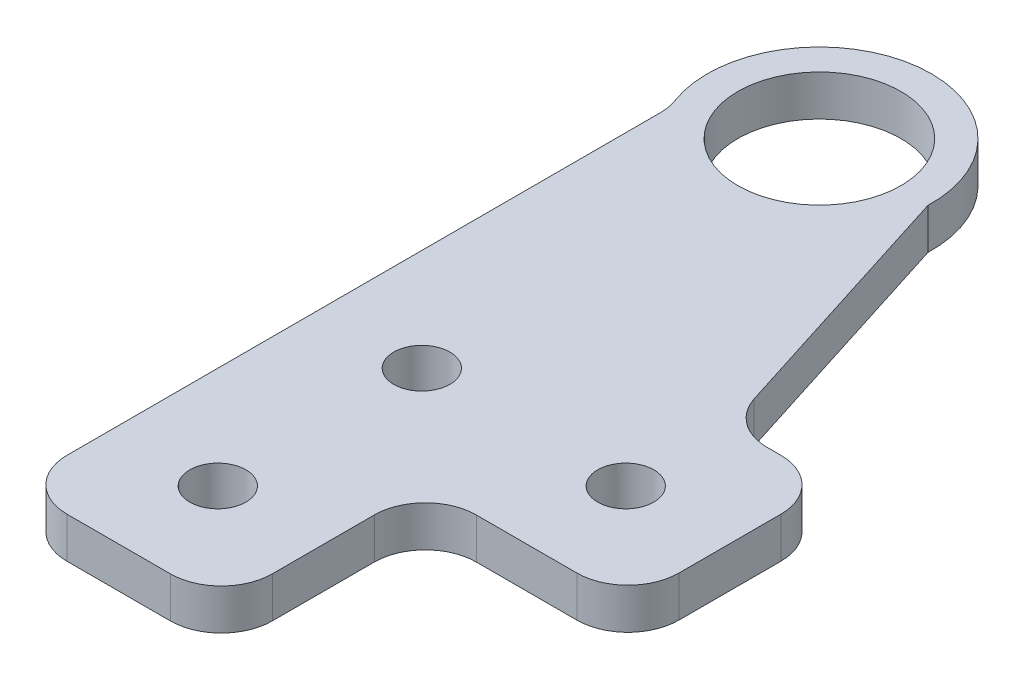
from build123d import *

# Parameters (mm, degrees)
CROQUIS1_R              = 2.75
CROQUIS1_R_2            = 8
SALIENTE_EXTRUIR1_DEPTH = 4


with BuildPart() as part:
    # Croquis1 → Saliente-Extruir1 (new body)
    with BuildSketch(Plane(origin=(0, 0, 0), x_dir=(1, 0, 0), z_dir=(0, 1, 0))):
        with BuildLine():
            Line((-19.683050508, 22.941797025), (-19.683050508, -35.249327106))
            ThreePointArc((-19.683050508, -35.249327106), (-18.218584414, -38.784861012), (-14.683050508, -40.249327106))
            Line((-14.683050508, -40.249327106), (-4.549566926, -40.249327106))
            ThreePointArc((-4.549566926, -40.249327106), (-1.01403302, -38.784861012), (0.450433074, -35.249327106))
            Line((0.450433074, -35.249327106), (0.450433074, -25.249327106))
            ThreePointArc((0.450433074, -25.249327106), (1.914899168, -21.7137932), (5.450433074, -20.249327106))
            Line((5.450433074, -20.249327106), (15.316949492, -20.249327106))
            ThreePointArc((15.316949492, -20.249327106), (18.852483398, -18.784861012), (20.316949492, -15.249327106))
            Line((20.316949492, -15.249327106), (20.316949492, -5.249327106))
            ThreePointArc((20.316949492, -5.249327106), (18.852483398, -1.7137932), (15.316949492, -0.249327106))
            Line((15.316949492, -0.249327106), (13.97720353, -0.249327106))
            ThreePointArc((13.97720353, -0.249327106), (11.023751057, 0.716181787), (9.210932436, 3.239825498))
            Line((9.210932436, 3.239825498), (1.302567045, 28.188350052))
            ThreePointArc((1.302567045, 28.188350052), (-11.475083798, 39.388167744), (-19.998351013, 24.689249641))
            ThreePointArc((-19.998351013, 24.689249641), (-19.762506967, 23.82963218), (-19.683050508, 22.941797025))
        make_face()
        with Locations(Location((10.316949492, -10.460860181, 0), (0, 0, 270))):
            Circle(CROQUIS1_R, mode=Mode.SUBTRACT)
        with Locations(Location((-9.683050508, -10.460860181, 0), (0, 0, 270))):
            Circle(CROQUIS1_R, mode=Mode.SUBTRACT)
        with Locations(Location((-9.683050508, -30.460860181, 0), (0, 0, 270))):
            Circle(CROQUIS1_R, mode=Mode.SUBTRACT)
        with Locations(Location((-9.692012125, 28.533645396, 0), (0, 0, 270))):
            Circle(CROQUIS1_R_2, mode=Mode.SUBTRACT)
    extrude(amount=SALIENTE_EXTRUIR1_DEPTH)


solid = part.part
